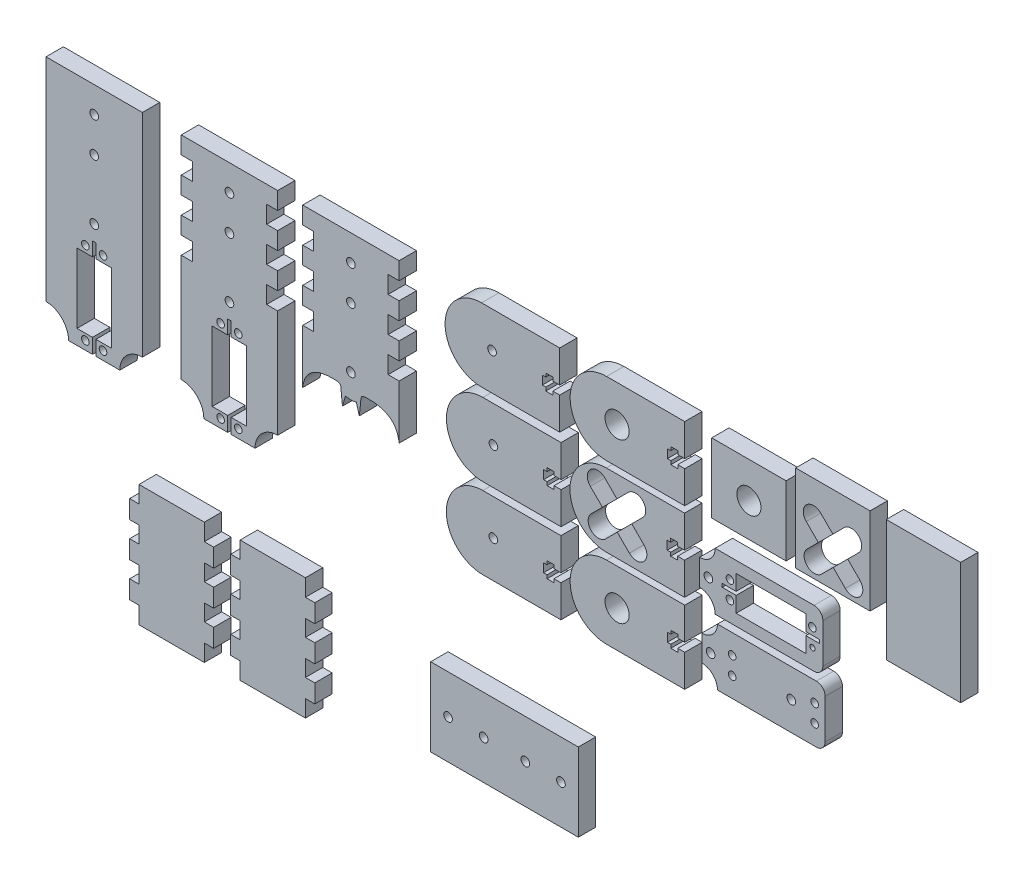
from build123d import *

# Parameters (mm, degrees)
SKETCH1_W              = 42.8
SKETCH1_H              = 50
BOSS_EXTRUDE1_DEPTH    = 10
SKETCH1_H_2            = 70
BOSS_EXTRUDE1_2_DEPTH  = 10
SKETCH1_R              = 2.19
SKETCH1_R_2            = 2.5
SKETCH1_R_3            = 1.5
BOSS_EXTRUDE1_3_DEPTH  = 10
BOSS_EXTRUDE1_4_DEPTH  = 10
BOSS_EXTRUDE1_5_DEPTH  = 10
BOSS_EXTRUDE1_6_DEPTH  = 10
BOSS_EXTRUDE1_7_DEPTH  = 10
BOSS_EXTRUDE1_8_DEPTH  = 10
SKETCH1_R_4            = 6.95
BOSS_EXTRUDE1_9_DEPTH  = 10
SKETCH1_H_3            = 40
BOSS_EXTRUDE1_10_DEPTH = 10
BOSS_EXTRUDE1_11_DEPTH = 10
BOSS_EXTRUDE1_12_DEPTH = 10
BOSS_EXTRUDE1_13_DEPTH = 10
BOSS_EXTRUDE1_14_DEPTH = 10
SKETCH1_W_2            = 85
SKETCH1_H_4            = 45
BOSS_EXTRUDE1_15_DEPTH = 10
BOSS_EXTRUDE1_16_DEPTH = 10
BOSS_EXTRUDE1_17_DEPTH = 10


with BuildPart() as part:
    # Sketch1 → Boss-Extrude1 (new body)
    with BuildSketch(Plane.XY):
        with Locations((-3943.59170535, 681.14211097)):
            Rectangle(SKETCH1_W, SKETCH1_H)
        with BuildLine():
            Line((-3951.935565368, 675.48211097), (-3958.912154207, 682.458699808))
            ThreePointArc((-3958.912154207, 682.458699808), (-3958.912154207, 690.802559826), (-3950.568294189, 690.802559826))
            Line((-3950.568294189, 690.802559826), (-3943.59170535, 683.825970988))
            Line((-3943.59170535, 683.825970988), (-3937.086322963, 690.331353375))
            ThreePointArc((-3937.086322963, 690.331353375), (-3928.742462945, 690.331353375), (-3928.742462945, 681.987493357))
            Line((-3928.742462945, 681.987493357), (-3935.052945312, 675.67701099))
            Line((-3935.052945312, 675.67701099), (-3928.076356473, 668.700422151))
            ThreePointArc((-3928.076356473, 668.700422151), (-3928.076356473, 660.356562133), (-3936.420216491, 660.356562133))
            Line((-3936.420216491, 660.356562133), (-3943.39680533, 667.333150972))
            Line((-3943.39680533, 667.333150972), (-3949.902187717, 660.827768585))
            ThreePointArc((-3949.902187717, 660.827768585), (-3958.342332865, 660.5319777), (-3958.440947755, 668.976728583))
            Line((-3958.440947755, 668.976728583), (-3951.935565368, 675.48211097))
        make_face(mode=Mode.SUBTRACT)
    extrude(amount=BOSS_EXTRUDE1_DEPTH)


with BuildPart() as body_2:
    # Sketch1 → Boss-Extrude1 2 (new body)
    with BuildSketch(Plane.XY):
        with Locations((-3891.431661687, 671.525375075)):
            Rectangle(SKETCH1_W, SKETCH1_H_2)
    extrude(amount=BOSS_EXTRUDE1_2_DEPTH)


with BuildPart() as body_3:
    # Sketch1 → Boss-Extrude1 3 (new body)
    with BuildSketch(Plane.XY):
        with BuildLine():
            Line((-3954.43106615, 642.903528225), (-4011.35106615, 642.903528225))
            ThreePointArc((-4011.35106615, 642.903528225), (-4013.987105119, 636.539567194), (-4020.35106615, 633.903528225))
            Line((-4020.35106615, 633.903528225), (-4020.35106615, 619.003528225))
            ThreePointArc((-4020.35106615, 619.003528225), (-4013.987105119, 616.367489255), (-4011.35106615, 610.003528225))
            Line((-4011.35106615, 610.003528225), (-3954.43106615, 610.003528225))
            ThreePointArc((-3954.43106615, 610.003528225), (-3950.838963701, 611.491425776), (-3949.35106615, 615.083528225))
            Line((-3949.35106615, 615.083528225), (-3949.35106615, 637.823528225))
            ThreePointArc((-3949.35106615, 637.823528225), (-3950.838963701, 641.415630673), (-3954.43106615, 642.903528225))
        make_face()
        with Locations((-4002.871218638, 621.368528225)):
            Circle(SKETCH1_R, mode=Mode.SUBTRACT)
        with Locations((-4002.871218638, 631.538528225)):
            Circle(SKETCH1_R, mode=Mode.SUBTRACT)
        with Locations((-3955.371218638, 631.538528225)):
            Circle(SKETCH1_R, mode=Mode.SUBTRACT)
        with Locations((-4015.269490791, 626.453528225)):
            Circle(SKETCH1_R_2, mode=Mode.SUBTRACT)
        with Locations((-3955.371218638, 621.368528225)):
            Circle(SKETCH1_R_3, mode=Mode.SUBTRACT)
        Polygon((-3959.181218638, 625.453528225), (-3959.181218638, 616.543528225), (-3999.281218638, 616.543528225), (-3999.281218638, 625.453528225), (-4007.281218638, 625.453528225), (-4007.281218638, 627.453528225), (-3999.281218638, 627.453528225), (-3999.281218638, 636.363528225), (-3959.181218638, 636.363528225), (-3959.181218638, 627.453528225), (-3951.35106615, 627.453528225), (-3951.35106615, 625.453528225), align=None, mode=Mode.SUBTRACT)
    extrude(amount=BOSS_EXTRUDE1_3_DEPTH)


with BuildPart() as body_4:
    # Sketch1 → Boss-Extrude1 4 (new body)
    with BuildSketch(Plane.XY):
        with BuildLine():
            Line((-4100.142695988, 604.808416818), (-4100.142695988, 586.308416818))
            Line((-4100.142695988, 586.308416818), (-4104.142695988, 586.308416818))
            Line((-4104.142695988, 586.308416818), (-4104.142695988, 588.308416818))
            Line((-4104.142695988, 588.308416818), (-4108.142695988, 588.308416818))
            Line((-4108.142695988, 588.308416818), (-4108.142695988, 586.308416818))
            Line((-4108.142695988, 586.308416818), (-4110.142695988, 586.308416818))
            Line((-4110.142695988, 586.308416818), (-4110.142695988, 581.308416818))
            Line((-4110.142695988, 581.308416818), (-4108.142695988, 581.308416818))
            Line((-4108.142695988, 581.308416818), (-4108.142695988, 579.308416818))
            Line((-4108.142695988, 579.308416818), (-4104.142695988, 579.308416818))
            Line((-4104.142695988, 579.308416818), (-4104.142695988, 581.308416818))
            Line((-4104.142695988, 581.308416818), (-4100.142695988, 581.308416818))
            Line((-4100.142695988, 581.308416818), (-4100.142695988, 562.808416818))
            Line((-4100.142695988, 562.808416818), (-4145.142695988, 562.808416818))
            ThreePointArc((-4145.142695988, 562.808416818), (-4166.142695988, 583.808416818), (-4145.142695988, 604.808416818))
            Line((-4145.142695988, 604.808416818), (-4100.142695988, 604.808416818))
        make_face()
        with Locations((-4139.082685736, 584.080189409)):
            Circle(SKETCH1_R_2, mode=Mode.SUBTRACT)
    extrude(amount=BOSS_EXTRUDE1_4_DEPTH)


with BuildPart() as body_5:
    # Sketch1 → Boss-Extrude1 5 (new body)
    with BuildSketch(Plane.XY):
        with BuildLine():
            Line((-4028.979303218, 651.628789098), (-4028.979303218, 633.128789098))
            Line((-4028.979303218, 633.128789098), (-4032.979303218, 633.128789098))
            Line((-4032.979303218, 633.128789098), (-4032.979303218, 635.128789098))
            Line((-4032.979303218, 635.128789098), (-4036.979303218, 635.128789098))
            Line((-4036.979303218, 635.128789098), (-4036.979303218, 633.128789098))
            Line((-4036.979303218, 633.128789098), (-4038.979303218, 633.128789098))
            Line((-4038.979303218, 633.128789098), (-4038.979303218, 628.128789098))
            Line((-4038.979303218, 628.128789098), (-4036.979303218, 628.128789098))
            Line((-4036.979303218, 628.128789098), (-4036.979303218, 626.128789098))
            Line((-4036.979303218, 626.128789098), (-4032.979303218, 626.128789098))
            Line((-4032.979303218, 626.128789098), (-4032.979303218, 628.128789098))
            Line((-4032.979303218, 628.128789098), (-4028.979303218, 628.128789098))
            Line((-4028.979303218, 628.128789098), (-4028.979303218, 609.628789098))
            Line((-4028.979303218, 609.628789098), (-4073.979303218, 609.628789098))
            ThreePointArc((-4073.979303218, 609.628789098), (-4094.979303218, 630.628789098), (-4073.979303218, 651.628789098))
            Line((-4073.979303218, 651.628789098), (-4028.979303218, 651.628789098))
        make_face()
        with BuildLine():
            Line((-4076.263152984, 630.900561689), (-4083.239741823, 637.877150528))
            ThreePointArc((-4083.239741823, 637.877150528), (-4083.239741823, 646.221010546), (-4074.895881805, 646.221010546))
            Line((-4074.895881805, 646.221010546), (-4067.919292966, 639.244421707))
            Line((-4067.919292966, 639.244421707), (-4061.413910579, 645.749804094))
            ThreePointArc((-4061.413910579, 645.749804094), (-4053.070050561, 645.749804094), (-4053.070050561, 637.405944076))
            Line((-4053.070050561, 637.405944076), (-4059.380532928, 631.09546171))
            Line((-4059.380532928, 631.09546171), (-4052.403944089, 624.118872871))
            ThreePointArc((-4052.403944089, 624.118872871), (-4052.403944089, 615.775012853), (-4060.747804107, 615.775012853))
            Line((-4060.747804107, 615.775012853), (-4067.724392946, 622.751601692))
            Line((-4067.724392946, 622.751601692), (-4074.229775333, 616.246219305))
            ThreePointArc((-4074.229775333, 616.246219305), (-4082.669920481, 615.950428419), (-4082.768535371, 624.395179302))
            Line((-4082.768535371, 624.395179302), (-4076.263152984, 630.900561689))
        make_face(mode=Mode.SUBTRACT)
    extrude(amount=BOSS_EXTRUDE1_5_DEPTH)


with BuildPart() as body_6:
    # Sketch1 → Boss-Extrude1 6 (new body)
    with BuildSketch(Plane.XY):
        with BuildLine():
            Line((-4019.044420598, 596.774421459), (-4019.044420598, 581.874421459))
            ThreePointArc((-4019.044420598, 581.874421459), (-4012.680459567, 579.238382489), (-4010.044420598, 572.874421459))
            Line((-4010.044420598, 572.874421459), (-3953.124420598, 572.874421459))
            ThreePointArc((-3953.124420598, 572.874421459), (-3949.532318149, 574.36231901), (-3948.044420598, 577.954421459))
            Line((-3948.044420598, 577.954421459), (-3948.044420598, 600.694421459))
            ThreePointArc((-3948.044420598, 600.694421459), (-3949.53231815, 604.286523907), (-3953.124420598, 605.774421459))
            Line((-3953.124420598, 605.774421459), (-4010.044420598, 605.774421459))
            ThreePointArc((-4010.044420598, 605.774421459), (-4012.680459567, 599.410460428), (-4019.044420598, 596.774421459))
        make_face()
        with Locations((-3954.064573086, 594.409421459)):
            Circle(SKETCH1_R, mode=Mode.SUBTRACT)
        with Locations((-4013.962845239, 589.324421459)):
            Circle(SKETCH1_R_2, mode=Mode.SUBTRACT)
        with Locations((-3954.064573086, 584.239421459)):
            Circle(SKETCH1_R, mode=Mode.SUBTRACT)
        with Locations((-4001.564573086, 584.239421459)):
            Circle(SKETCH1_R, mode=Mode.SUBTRACT)
        with Locations((-4001.564573086, 594.409421459)):
            Circle(SKETCH1_R, mode=Mode.SUBTRACT)
        with Locations((-3967.534573086, 589.324421459)):
            Circle(SKETCH1_R_2, mode=Mode.SUBTRACT)
    extrude(amount=BOSS_EXTRUDE1_6_DEPTH)


with BuildPart() as body_7:
    # Sketch1 → Boss-Extrude1 7 (new body)
    with BuildSketch(Plane.XY):
        with BuildLine():
            Line((-4269.607390941, 685.323706316), (-4263.257390941, 685.323706316))
            Line((-4263.257390941, 685.323706316), (-4263.257390941, 695.32370632))
            Line((-4263.257390941, 695.32370632), (-4318.757390941, 695.32370632))
            Line((-4318.757390941, 695.32370632), (-4318.757390941, 685.32370632))
            Line((-4318.757390941, 685.32370632), (-4312.407390941, 685.32370632))
            Line((-4312.407390941, 685.32370632), (-4312.407390941, 675.32370632))
            Line((-4312.407390941, 675.32370632), (-4318.757390941, 675.32370632))
            Line((-4318.757390941, 675.32370632), (-4318.757390941, 665.32370632))
            Line((-4318.757390941, 665.32370632), (-4312.407390941, 665.32370632))
            Line((-4312.407390941, 665.32370632), (-4312.407390941, 655.32370632))
            Line((-4312.407390941, 655.32370632), (-4318.757390941, 655.32370632))
            Line((-4318.757390941, 655.32370632), (-4318.757390941, 645.32370632))
            Line((-4318.757390941, 645.32370632), (-4312.407390941, 645.32370632))
            Line((-4312.407390941, 645.32370632), (-4312.407390941, 635.32370632))
            Line((-4312.407390941, 635.32370632), (-4318.757390941, 635.32370632))
            Line((-4318.757390941, 635.32370632), (-4318.757390941, 573.32370632))
            ThreePointArc((-4318.757390941, 573.32370632), (-4309.565002786, 569.516094475), (-4305.757390941, 560.32370632))
            Line((-4305.757390941, 560.32370632), (-4292.007390941, 560.32370632))
            Line((-4292.007390941, 560.32370632), (-4292.007390941, 568.82370632))
            Line((-4292.007390941, 568.82370632), (-4300.917390941, 568.82370632))
            Line((-4300.917390941, 568.82370632), (-4300.917390941, 608.92370632))
            Line((-4300.917390941, 608.92370632), (-4292.007390941, 608.92370632))
            Line((-4292.007390941, 608.92370632), (-4292.007390941, 616.92370632))
            Line((-4292.007390941, 616.92370632), (-4290.007390941, 616.92370632))
            Line((-4290.007390941, 616.92370632), (-4290.007390941, 608.92370632))
            Line((-4290.007390941, 608.92370632), (-4281.097390941, 608.92370632))
            Line((-4281.097390941, 608.92370632), (-4281.097390941, 568.82370632))
            Line((-4281.097390941, 568.82370632), (-4290.007390941, 568.82370632))
            Line((-4290.007390941, 568.82370632), (-4290.007390941, 560.32370632))
            Line((-4290.007390941, 560.32370632), (-4276.257390941, 560.32370632))
            ThreePointArc((-4276.257390941, 560.32370632), (-4272.449779096, 569.516094475), (-4263.257390941, 573.32370632))
            Line((-4263.257390941, 573.32370632), (-4263.257390941, 635.32370632))
            Line((-4263.257390941, 635.32370632), (-4269.607390941, 635.32370632))
            Line((-4269.607390941, 635.32370632), (-4269.607390941, 645.323706316))
            Line((-4269.607390941, 645.323706316), (-4263.257390941, 645.323706316))
            Line((-4263.257390941, 645.323706316), (-4263.257390941, 655.323706316))
            Line((-4263.257390941, 655.323706316), (-4269.607390941, 655.323706316))
            Line((-4269.607390941, 655.323706316), (-4269.607390941, 665.323706316))
            Line((-4269.607390941, 665.323706316), (-4263.257390941, 665.323706316))
            Line((-4263.257390941, 665.323706316), (-4263.257390941, 675.323706316))
            Line((-4263.257390941, 675.323706316), (-4269.607390941, 675.323706316))
            Line((-4269.607390941, 675.323706316), (-4269.607390941, 685.323706316))
        make_face()
        with Locations((-4285.922390941, 565.23370632)):
            Circle(SKETCH1_R, mode=Mode.SUBTRACT)
        with Locations((-4296.092390941, 565.23370632)):
            Circle(SKETCH1_R, mode=Mode.SUBTRACT)
        with Locations((-4296.092390941, 612.73370632)):
            Circle(SKETCH1_R, mode=Mode.SUBTRACT)
        with Locations((-4285.922390941, 612.73370632)):
            Circle(SKETCH1_R, mode=Mode.SUBTRACT)
        with Locations((-4291.007390941, 680.32370632)):
            Circle(SKETCH1_R_2, mode=Mode.SUBTRACT)
        with Locations((-4291.007390941, 625.82370632)):
            Circle(SKETCH1_R_2, mode=Mode.SUBTRACT)
        with Locations((-4291.007390941, 660.32370632)):
            Circle(SKETCH1_R_2, mode=Mode.SUBTRACT)
    extrude(amount=BOSS_EXTRUDE1_7_DEPTH)


with BuildPart() as body_8:
    # Sketch1 → Boss-Extrude1 8 (new body)
    with BuildSketch(Plane.XY):
        Polygon((-4290.268422476, 460.516026657), (-4290.268422476, 450.016026657), (-4284.868422476, 450.016026657), (-4284.868422476, 440.266026657), (-4247.268422476, 440.266026657), (-4247.268422476, 450.016026657), (-4241.868422476, 450.016026657), (-4241.868422476, 460.516026657), (-4247.268422476, 460.516026657), (-4247.268422476, 470.016026657), (-4241.868422476, 470.016026657), (-4241.868422476, 480.516026657), (-4247.268422476, 480.516026657), (-4247.268422476, 490.016026657), (-4241.868422476, 490.016026657), (-4241.868422476, 500.516026657), (-4247.268422476, 500.516026657), (-4247.268422476, 510.266026657), (-4284.868422476, 510.266026657), (-4284.868422476, 500.516026657), (-4290.268422476, 500.516026657), (-4290.268422476, 490.016026657), (-4284.868422476, 490.016026657), (-4284.868422476, 480.516026657), (-4290.268422476, 480.516026657), (-4290.268422476, 470.016026657), (-4284.868422476, 470.016026657), (-4284.868422476, 460.516026657), align=None)
    extrude(amount=BOSS_EXTRUDE1_8_DEPTH)


with BuildPart() as body_9:
    # Sketch1 → Boss-Extrude1 9 (new body)
    with BuildSketch(Plane.XY):
        with BuildLine():
            Line((-4028.8790326, 605.774421459), (-4028.8790326, 587.274421459))
            Line((-4028.8790326, 587.274421459), (-4032.8790326, 587.274421459))
            Line((-4032.8790326, 587.274421459), (-4032.8790326, 589.274421459))
            Line((-4032.8790326, 589.274421459), (-4036.8790326, 589.274421459))
            Line((-4036.8790326, 589.274421459), (-4036.8790326, 587.274421459))
            Line((-4036.8790326, 587.274421459), (-4038.8790326, 587.274421459))
            Line((-4038.8790326, 587.274421459), (-4038.8790326, 582.274421459))
            Line((-4038.8790326, 582.274421459), (-4036.8790326, 582.274421459))
            Line((-4036.8790326, 582.274421459), (-4036.8790326, 580.274421459))
            Line((-4036.8790326, 580.274421459), (-4032.8790326, 580.274421459))
            Line((-4032.8790326, 580.274421459), (-4032.8790326, 582.274421459))
            Line((-4032.8790326, 582.274421459), (-4028.8790326, 582.274421459))
            Line((-4028.8790326, 582.274421459), (-4028.8790326, 563.774421459))
            Line((-4028.8790326, 563.774421459), (-4073.8790326, 563.774421459))
            ThreePointArc((-4073.8790326, 563.774421459), (-4094.8790326, 584.774421459), (-4073.8790326, 605.774421459))
            Line((-4073.8790326, 605.774421459), (-4028.8790326, 605.774421459))
        make_face()
        with Locations((-4067.819022348, 584.774421459)):
            Circle(SKETCH1_R_4, mode=Mode.SUBTRACT)
    extrude(amount=BOSS_EXTRUDE1_9_DEPTH)


with BuildPart() as body_10:
    # Sketch1 → Boss-Extrude1 10 (new body)
    with BuildSketch(Plane.XY):
        with Locations((-3991.947107761, 676.969437938)):
            Rectangle(SKETCH1_W, SKETCH1_H_3)
        with Locations((-3991.947107761, 676.309437938)):
            Circle(SKETCH1_R_4, mode=Mode.SUBTRACT)
    extrude(amount=BOSS_EXTRUDE1_10_DEPTH)


with BuildPart() as body_11:
    # Sketch1 → Boss-Extrude1 11 (new body)
    with BuildSketch(Plane.XY):
        with BuildLine():
            Line((-4028.8790326, 697.32370632), (-4028.8790326, 678.82370632))
            Line((-4028.8790326, 678.82370632), (-4032.8790326, 678.82370632))
            Line((-4032.8790326, 678.82370632), (-4032.8790326, 680.82370632))
            Line((-4032.8790326, 680.82370632), (-4036.8790326, 680.82370632))
            Line((-4036.8790326, 680.82370632), (-4036.8790326, 678.82370632))
            Line((-4036.8790326, 678.82370632), (-4038.8790326, 678.82370632))
            Line((-4038.8790326, 678.82370632), (-4038.8790326, 673.82370632))
            Line((-4038.8790326, 673.82370632), (-4036.8790326, 673.82370632))
            Line((-4036.8790326, 673.82370632), (-4036.8790326, 671.82370632))
            Line((-4036.8790326, 671.82370632), (-4032.8790326, 671.82370632))
            Line((-4032.8790326, 671.82370632), (-4032.8790326, 673.82370632))
            Line((-4032.8790326, 673.82370632), (-4028.8790326, 673.82370632))
            Line((-4028.8790326, 673.82370632), (-4028.8790326, 655.32370632))
            Line((-4028.8790326, 655.32370632), (-4073.8790326, 655.32370632))
            ThreePointArc((-4073.8790326, 655.32370632), (-4094.8790326, 676.32370632), (-4073.8790326, 697.32370632))
            Line((-4073.8790326, 697.32370632), (-4028.8790326, 697.32370632))
        make_face()
        with Locations((-4067.819022348, 676.32370632)):
            Circle(SKETCH1_R_4, mode=Mode.SUBTRACT)
    extrude(amount=BOSS_EXTRUDE1_11_DEPTH)


with BuildPart() as body_12:
    # Sketch1 → Boss-Extrude1 12 (new body)
    with BuildSketch(Plane.XY):
        with BuildLine():
            Line((-4100.85983613, 698.036635234), (-4100.85983613, 679.536635234))
            Line((-4100.85983613, 679.536635234), (-4104.85983613, 679.536635234))
            Line((-4104.85983613, 679.536635234), (-4104.85983613, 681.536635234))
            Line((-4104.85983613, 681.536635234), (-4108.85983613, 681.536635234))
            Line((-4108.85983613, 681.536635234), (-4108.85983613, 679.536635234))
            Line((-4108.85983613, 679.536635234), (-4110.85983613, 679.536635234))
            Line((-4110.85983613, 679.536635234), (-4110.85983613, 674.536635234))
            Line((-4110.85983613, 674.536635234), (-4108.85983613, 674.536635234))
            Line((-4108.85983613, 674.536635234), (-4108.85983613, 672.536635234))
            Line((-4108.85983613, 672.536635234), (-4104.85983613, 672.536635234))
            Line((-4104.85983613, 672.536635234), (-4104.85983613, 674.536635234))
            Line((-4104.85983613, 674.536635234), (-4100.85983613, 674.536635234))
            Line((-4100.85983613, 674.536635234), (-4100.85983613, 656.036635234))
            Line((-4100.85983613, 656.036635234), (-4145.85983613, 656.036635234))
            ThreePointArc((-4145.85983613, 656.036635234), (-4166.85983613, 677.036635234), (-4145.85983613, 698.036635234))
            Line((-4145.85983613, 698.036635234), (-4100.85983613, 698.036635234))
        make_face()
        with Locations((-4139.799825878, 677.308407826)):
            Circle(SKETCH1_R_2, mode=Mode.SUBTRACT)
    extrude(amount=BOSS_EXTRUDE1_12_DEPTH)


with BuildPart() as body_13:
    # Sketch1 → Boss-Extrude1 13 (new body)
    with BuildSketch(Plane.XY):
        with BuildLine():
            Line((-4100.08534353, 651.248581467), (-4100.08534353, 632.748581467))
            Line((-4100.08534353, 632.748581467), (-4104.08534353, 632.748581467))
            Line((-4104.08534353, 632.748581467), (-4104.08534353, 634.748581467))
            Line((-4104.08534353, 634.748581467), (-4108.08534353, 634.748581467))
            Line((-4108.08534353, 634.748581467), (-4108.08534353, 632.748581467))
            Line((-4108.08534353, 632.748581467), (-4110.08534353, 632.748581467))
            Line((-4110.08534353, 632.748581467), (-4110.08534353, 627.748581467))
            Line((-4110.08534353, 627.748581467), (-4108.08534353, 627.748581467))
            Line((-4108.08534353, 627.748581467), (-4108.08534353, 625.748581467))
            Line((-4108.08534353, 625.748581467), (-4104.08534353, 625.748581467))
            Line((-4104.08534353, 625.748581467), (-4104.08534353, 627.748581467))
            Line((-4104.08534353, 627.748581467), (-4100.08534353, 627.748581467))
            Line((-4100.08534353, 627.748581467), (-4100.08534353, 609.248581467))
            Line((-4100.08534353, 609.248581467), (-4145.08534353, 609.248581467))
            ThreePointArc((-4145.08534353, 609.248581467), (-4166.08534353, 630.248581467), (-4145.08534353, 651.248581467))
            Line((-4145.08534353, 651.248581467), (-4100.08534353, 651.248581467))
        make_face()
        with Locations((-4139.025333278, 630.520354059)):
            Circle(SKETCH1_R_2, mode=Mode.SUBTRACT)
    extrude(amount=BOSS_EXTRUDE1_13_DEPTH)


with BuildPart() as body_14:
    # Sketch1 → Boss-Extrude1 14 (new body)
    with BuildSketch(Plane.XY):
        with BuildLine():
            Line((-4396.623386359, 695.32370632), (-4396.623386359, 573.32370632))
            ThreePointArc((-4396.623386359, 573.32370632), (-4387.430998204, 569.516094475), (-4383.623386359, 560.32370632))
            Line((-4383.623386359, 560.32370632), (-4369.873386359, 560.32370632))
            Line((-4369.873386359, 560.32370632), (-4369.873386359, 568.82370632))
            Line((-4369.873386359, 568.82370632), (-4378.783386359, 568.82370632))
            Line((-4378.783386359, 568.82370632), (-4378.783386359, 608.92370632))
            Line((-4378.783386359, 608.92370632), (-4369.873386359, 608.92370632))
            Line((-4369.873386359, 608.92370632), (-4369.873386359, 616.92370632))
            Line((-4369.873386359, 616.92370632), (-4367.873386359, 616.92370632))
            Line((-4367.873386359, 616.92370632), (-4367.873386359, 608.92370632))
            Line((-4367.873386359, 608.92370632), (-4358.963386359, 608.92370632))
            Line((-4358.963386359, 608.92370632), (-4358.963386359, 568.82370632))
            Line((-4358.963386359, 568.82370632), (-4367.873386359, 568.82370632))
            Line((-4367.873386359, 568.82370632), (-4367.873386359, 560.32370632))
            Line((-4367.873386359, 560.32370632), (-4354.123386359, 560.32370632))
            ThreePointArc((-4354.123386359, 560.32370632), (-4350.315774515, 569.516094475), (-4341.123386359, 573.32370632))
            Line((-4341.123386359, 573.32370632), (-4341.123386359, 695.32370632))
            Line((-4341.123386359, 695.32370632), (-4396.623386359, 695.32370632))
        make_face()
        with Locations((-4368.873386359, 660.32370632)):
            Circle(SKETCH1_R_2, mode=Mode.SUBTRACT)
        with Locations((-4368.873386359, 625.82370632)):
            Circle(SKETCH1_R_2, mode=Mode.SUBTRACT)
        with Locations((-4368.873386359, 680.32370632)):
            Circle(SKETCH1_R_2, mode=Mode.SUBTRACT)
        with Locations((-4373.958386359, 612.73370632)):
            Circle(SKETCH1_R, mode=Mode.SUBTRACT)
        with Locations((-4363.788386359, 612.73370632)):
            Circle(SKETCH1_R, mode=Mode.SUBTRACT)
        with Locations((-4363.788386359, 565.23370632)):
            Circle(SKETCH1_R, mode=Mode.SUBTRACT)
        with Locations((-4373.958386359, 565.23370632)):
            Circle(SKETCH1_R, mode=Mode.SUBTRACT)
    extrude(amount=BOSS_EXTRUDE1_14_DEPTH)


with BuildPart() as body_15:
    # Sketch1 → Boss-Extrude1 15 (new body)
    with BuildSketch(Plane.XY):
        with Locations((-4132.642695988, 481.928244878)):
            Rectangle(SKETCH1_W_2, SKETCH1_H_4)
        with Locations((-4144.642695988, 481.928244878)):
            Circle(SKETCH1_R_2, mode=Mode.SUBTRACT)
        with Locations((-4120.642695988, 481.928244878)):
            Circle(SKETCH1_R_2, mode=Mode.SUBTRACT)
        with Locations((-4165.142695988, 481.928244878)):
            Circle(SKETCH1_R_2, mode=Mode.SUBTRACT)
        with Locations((-4100.142695988, 481.928244878)):
            Circle(SKETCH1_R_2, mode=Mode.SUBTRACT)
    extrude(amount=BOSS_EXTRUDE1_15_DEPTH)


with BuildPart() as body_16:
    # Sketch1 → Boss-Extrude1 16 (new body)
    with BuildSketch(Plane.XY):
        with BuildLine():
            Line((-4224.20861951, 612.468697847), (-4225.919175169, 606.47965742))
            add(Edge.make_bspline(
                [(-4225.919175169, 606.47965742), (-4227.421480515, 615.544920276), (-4225.417897454, 617.343963999), (-4229.791717842, 617.51576758)],
                knots=[0, 0, 0, 0, 1, 1, 1, 1], degree=3))
            add(Edge.make_bspline(
                [(-4229.791717842, 617.51576758), (-4247.288332408, 618.182349979), (-4248.826443607, 604.32370632)],
                knots=[0, 0, 0, 1, 1, 1], degree=2))
            Line((-4248.826443607, 604.32370632), (-4248.826443607, 635.32370632))
            Line((-4248.826443607, 635.32370632), (-4242.476443607, 635.32370632))
            Line((-4242.476443607, 635.32370632), (-4242.476443607, 645.32370632))
            Line((-4242.476443607, 645.32370632), (-4248.826443607, 645.32370632))
            Line((-4248.826443607, 645.32370632), (-4248.826443607, 655.32370632))
            Line((-4248.826443607, 655.32370632), (-4242.476443607, 655.32370632))
            Line((-4242.476443607, 655.32370632), (-4242.476443607, 665.32370632))
            Line((-4242.476443607, 665.32370632), (-4248.826443607, 665.32370632))
            Line((-4248.826443607, 665.32370632), (-4248.826443607, 675.32370632))
            Line((-4248.826443607, 675.32370632), (-4242.476443607, 675.32370632))
            Line((-4242.476443607, 675.32370632), (-4242.476443607, 685.32370632))
            Line((-4242.476443607, 685.32370632), (-4248.826443607, 685.32370632))
            Line((-4248.826443607, 685.32370632), (-4248.826443607, 695.32370632))
            Line((-4248.826443607, 695.32370632), (-4193.326443609, 695.32370632))
            Line((-4193.326443609, 695.32370632), (-4193.326443609, 685.32370632))
            Line((-4193.326443609, 685.32370632), (-4199.676443609, 685.32370632))
            Line((-4199.676443609, 685.32370632), (-4199.676443609, 675.32370632))
            Line((-4199.676443609, 675.32370632), (-4193.326443609, 675.32370632))
            Line((-4193.326443609, 675.32370632), (-4193.326443609, 665.32370632))
            Line((-4193.326443609, 665.32370632), (-4199.676443609, 665.32370632))
            Line((-4199.676443609, 665.32370632), (-4199.676443609, 655.32370632))
            Line((-4199.676443609, 655.32370632), (-4193.326443609, 655.32370632))
            Line((-4193.326443609, 655.32370632), (-4193.326443609, 645.32370632))
            Line((-4193.326443609, 645.32370632), (-4199.676443609, 645.32370632))
            Line((-4199.676443609, 645.32370632), (-4199.676443609, 635.32370632))
            Line((-4199.676443609, 635.32370632), (-4193.326443609, 635.32370632))
            Line((-4193.326443609, 635.32370632), (-4193.326443609, 604.32370632))
            add(Edge.make_bspline(
                [(-4212.361169373, 617.51576758), (-4194.864554808, 618.182349979), (-4193.326443609, 604.32370632)],
                knots=[0, 0, 0, 1, 1, 1], degree=2))
            add(Edge.make_bspline(
                [(-4216.233712047, 606.47965742), (-4214.731406701, 615.544920276), (-4216.734989762, 617.343963999), (-4212.361169373, 617.51576758)],
                knots=[0, 0, 0, 0, 1, 1, 1, 1], degree=3))
            Line((-4216.233712047, 606.47965742), (-4217.944267705, 612.468697847))
            add(Edge.make_bspline(
                [(-4221.076443608, 611.989090419), (-4219.635654742, 611.995030937), (-4217.944267705, 612.468697847)],
                knots=[0, 0, 0, 1, 1, 1], degree=2))
            add(Edge.make_bspline(
                [(-4221.076443608, 611.989090419), (-4222.517232473, 611.995030937), (-4224.20861951, 612.468697847)],
                knots=[0, 0, 0, 1, 1, 1], degree=2))
        make_face()
        with Locations((-4221.076443608, 660.32370632)):
            Circle(SKETCH1_R_2, mode=Mode.SUBTRACT)
        with Locations((-4221.076443608, 625.82370632)):
            Circle(SKETCH1_R_2, mode=Mode.SUBTRACT)
        with Locations((-4221.076443608, 680.32370632)):
            Circle(SKETCH1_R_2, mode=Mode.SUBTRACT)
    extrude(amount=BOSS_EXTRUDE1_16_DEPTH)


with BuildPart() as body_17:
    # Sketch1 → Boss-Extrude1 17 (new body)
    with BuildSketch(Plane.XY):
        Polygon((-4348.484705126, 459.121656019), (-4348.484705126, 448.621656019), (-4343.084705126, 448.621656019), (-4343.084705126, 438.871656019), (-4305.484705126, 438.871656019), (-4305.484705126, 448.621656019), (-4300.084705126, 448.621656019), (-4300.084705126, 459.121656019), (-4305.484705126, 459.121656019), (-4305.484705126, 468.621656019), (-4300.084705126, 468.621656019), (-4300.084705126, 479.121656019), (-4305.484705126, 479.121656019), (-4305.484705126, 488.621656019), (-4300.084705126, 488.621656019), (-4300.084705126, 499.121656019), (-4305.484705126, 499.121656019), (-4305.484705126, 508.871656019), (-4343.084705126, 508.871656019), (-4343.084705126, 499.121656019), (-4348.484705126, 499.121656019), (-4348.484705126, 488.621656019), (-4343.084705126, 488.621656019), (-4343.084705126, 479.121656019), (-4348.484705126, 479.121656019), (-4348.484705126, 468.621656019), (-4343.084705126, 468.621656019), (-4343.084705126, 459.121656019), align=None)
    extrude(amount=BOSS_EXTRUDE1_17_DEPTH)


solid = Compound([part.part, body_2.part, body_3.part, body_4.part, body_5.part, body_6.part, body_7.part, body_8.part, body_9.part, body_10.part, body_11.part, body_12.part, body_13.part, body_14.part, body_15.part, body_16.part, body_17.part])
